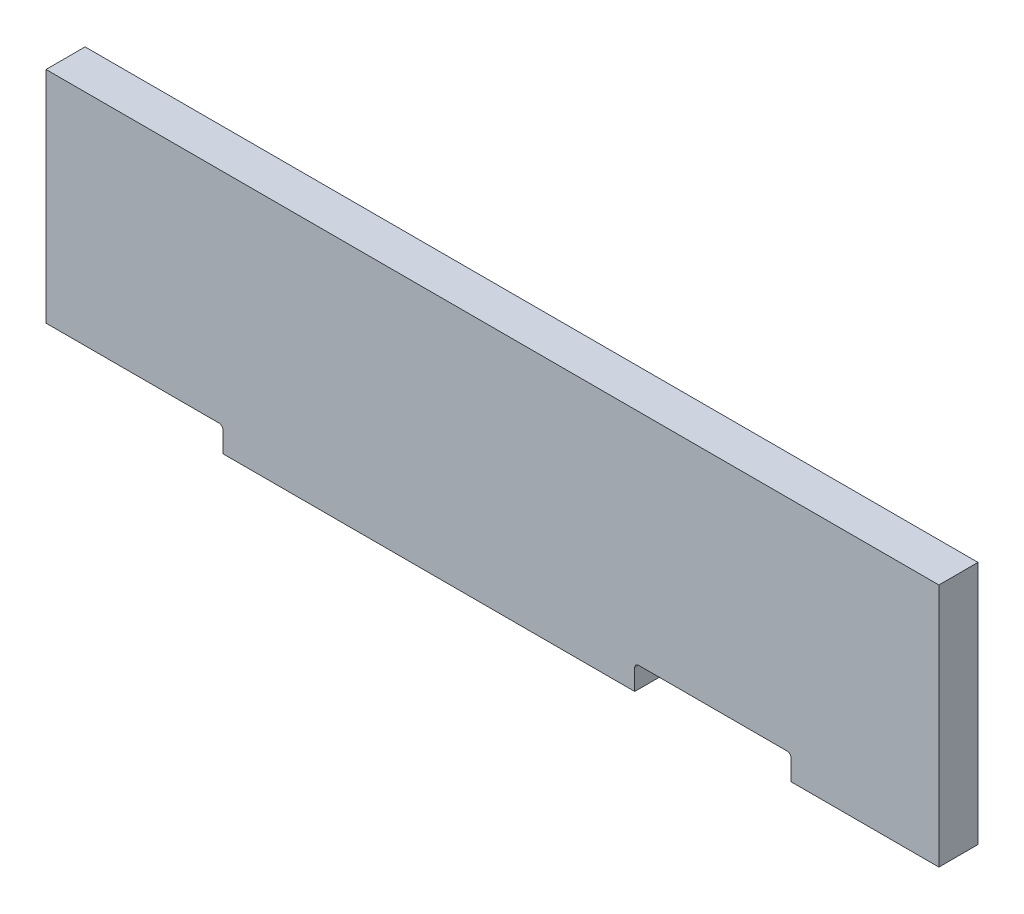
from build123d import *

# Parameters (mm, degrees)
SKETCH1_W           = 435
SKETCH1_H           = 119.05
BOSS_EXTRUDE1_DEPTH = 19.05
SKETCH2_W           = 76.2
SKETCH2_H           = 12
CUT_EXTRUDE1_DEPTH  = 324.319973092
FILLET1_R           = 2


with BuildPart() as part:
    # Sketch1 → Boss-Extrude1 (new body)
    with BuildSketch(Plane.XY):
        with Locations((82.5, 59.525)):
            Rectangle(SKETCH1_W, SKETCH1_H)
    extrude(amount=BOSS_EXTRUDE1_DEPTH)

    # Sketch2 → Cut-Extrude1 (cut, through all)
    with BuildSketch(Plane.XY.offset(19.05)):
        Polygon((-48.8, 12), (-125, 12), (-135, 12), (-135, 0), (-125, 0), (-48.8, 0), align=None)
        with Locations((189.9, 6)):
            Rectangle(SKETCH2_W, SKETCH2_H)
    extrude(amount=-CUT_EXTRUDE1_DEPTH, mode=Mode.SUBTRACT)

    # Fillet1
    fillet1_edges = [part.edges().sort_by_distance(p)[0] for p in [
        (-48.8, 12, 9.525),
        (151.8, 12, 9.525),
        (228, 12, 9.525),
    ]]
    fillet(fillet1_edges, radius=FILLET1_R)


solid = part.part
